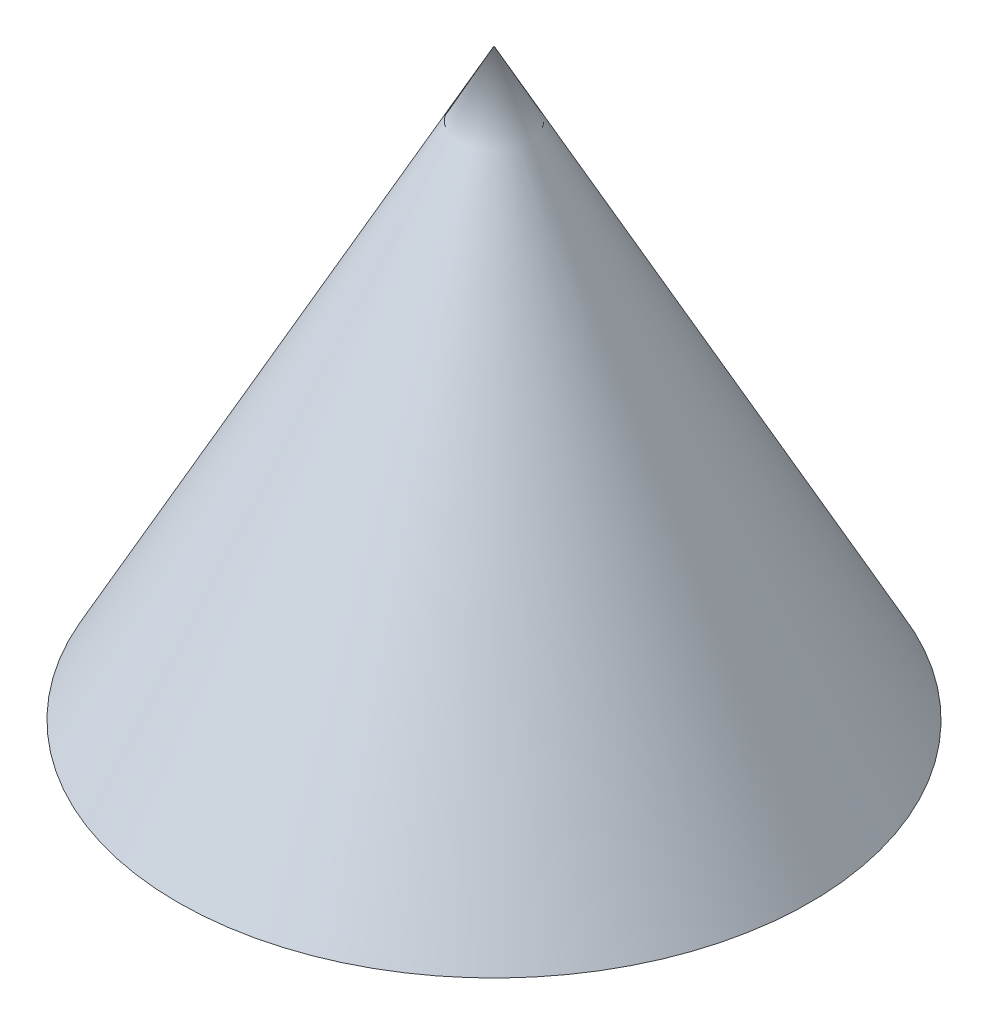
from build123d import *

# Parameters (mm, degrees)
SKETCH_2_R          = 0.9
CUT_EXTRUDE_1_DEPTH = 3


with BuildPart() as part:
    # ｽｹｯﾁ1 → 回転1 (revolve)
    with BuildSketch(Plane.XY, mode=Mode.PRIVATE) as revolve_1_sk:
        Polygon((0, 0), (0, 6), (-3.25, 0), align=None)
    revolve(revolve_1_sk.sketch.rotate(Axis((0, 0, 0), (0, 1, 0)), 270), axis=Axis((0, 0, 0), (0, 1, 0)))

    # ｽｹｯﾁ2 → ｶｯﾄ - 押し出し1 (cut)
    with BuildSketch(Plane.XZ):
        with Locations(Location((0, 0, 0), (0, 0, 270))):
            Circle(SKETCH_2_R)
    extrude(amount=-CUT_EXTRUDE_1_DEPTH, mode=Mode.SUBTRACT)


solid = part.part
